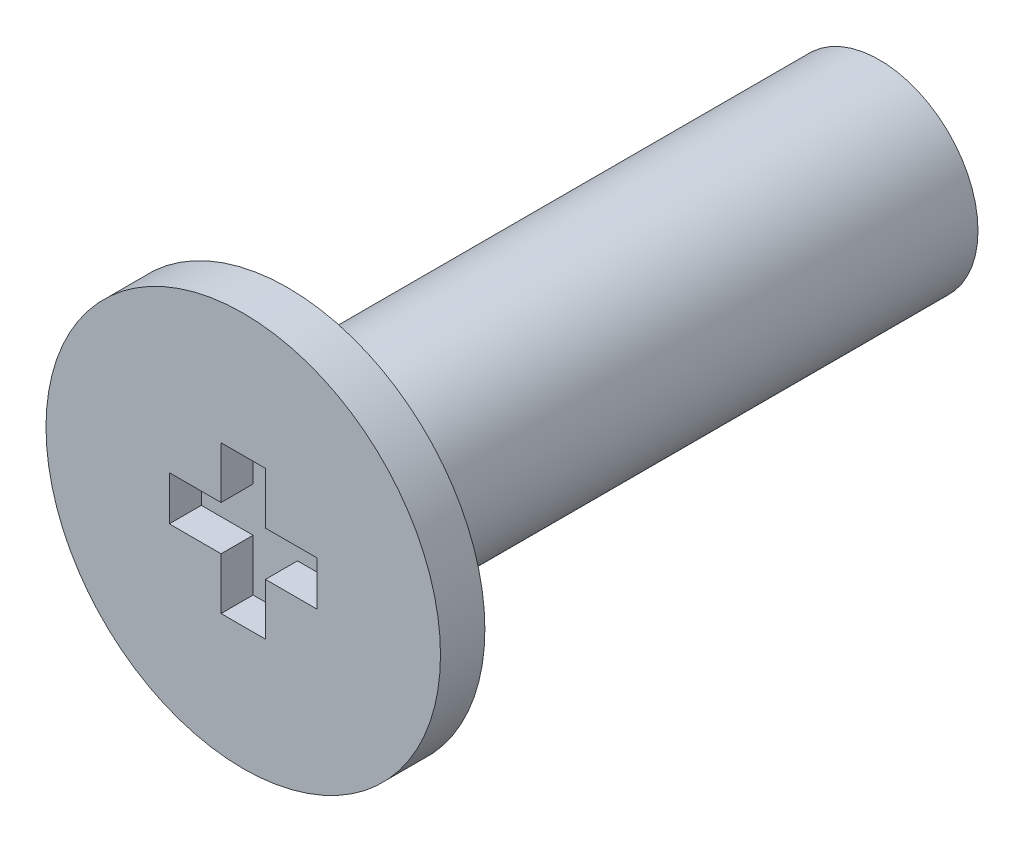
from build123d import *

# Parameters (mm, degrees)
SKETCH_1_R        = 2
EXTRUDE_198_DEPTH = 12
SKETCH_6_W        = 4
SKETCH_6_H        = 0.9
PH2_START         = 0.91
PH2_DEPTH         = 0.66


with BuildPart() as part:
    # 草图1 → Extrude 198 (new body)
    with BuildSketch(Plane.XY):
        Circle(SKETCH_1_R)
    extrude(amount=-EXTRUDE_198_DEPTH)

    # 草图6 → Revolve 324 (revolve)
    with BuildSketch(Plane(origin=(0, 0, 0), x_dir=(1, 0, 0), z_dir=(0, 1, 0)), mode=Mode.PRIVATE) as revolve_324_sk:
        with Locations((2, -0.45)):
            Rectangle(SKETCH_6_W, SKETCH_6_H)
    revolve(revolve_324_sk.sketch.rotate(Axis((0, 0, -2), (0, 0, 1)), 180), axis=Axis((0, 0, -2), (0, 0, 1)))

    # 草图7 → 十字槽_PH2_简化 (cut)
    with BuildSketch(Plane.XY.offset(PH2_START)):
        Polygon((-0.45, -1.5), (0.45, -1.5), (0.45, -0.45), (1.5, -0.45), (1.5, 0.45), (0.45, 0.45), (0.45, 1.5), (-0.45, 1.5), (-0.45, 0.45), (-1.5, 0.45), (-1.5, -0.45), (-0.45, -0.45), align=None)
    extrude(amount=-PH2_DEPTH, mode=Mode.SUBTRACT)


solid = part.part
